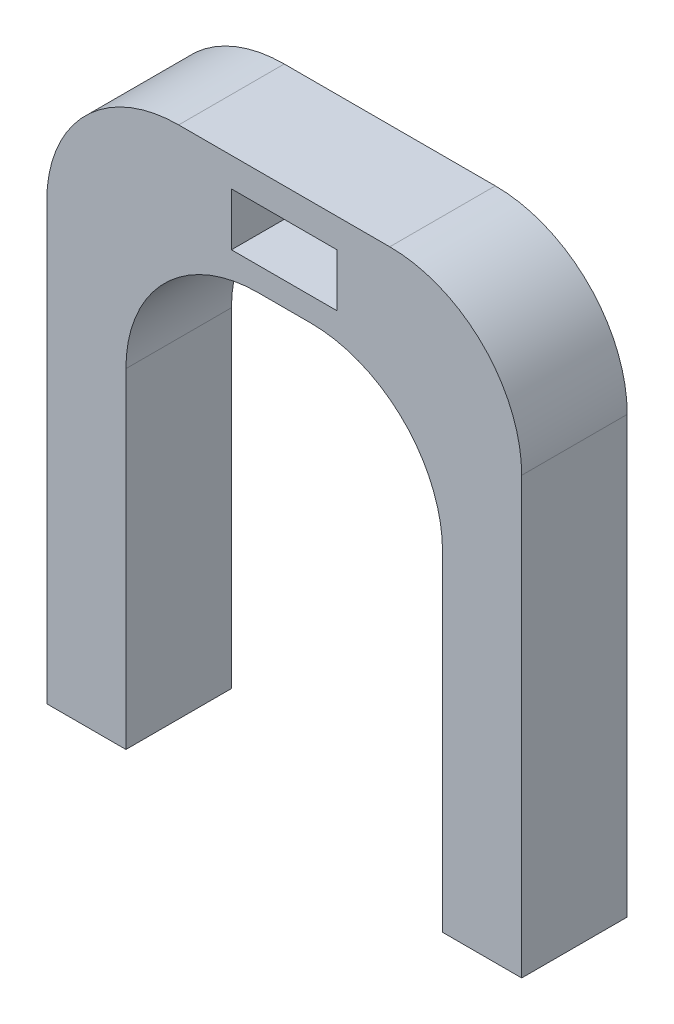
from build123d import *

# Parameters (mm, degrees)
SKETCH_2_W          = 18
SKETCH_2_H          = 21.5
EXTRUDE_1_DEPTH     = 4
SKETCH_3_W          = 12
SKETCH_3_H          = 17.5
CUT_EXTRUDE_1_DEPTH = 29.324018077
FILLET_1_R          = 5
FILLET_2_R          = 5
SKETCH_4_W          = 4
SKETCH_4_H          = 2
CUT_EXTRUDE_2_DEPTH = 29.324018077


with BuildPart() as part:
    # ｽｹｯﾁ2 → ﾎﾞｽ - 押し出し1 (new body)
    with BuildSketch(Plane.XY):
        with Locations((9, 10.75)):
            Rectangle(SKETCH_2_W, SKETCH_2_H)
    extrude(amount=EXTRUDE_1_DEPTH)

    # ｽｹｯﾁ3 → ｶｯﾄ - 押し出し1 (cut, through all)
    with BuildSketch(Plane.XY.offset(4)):
        with Locations((9, 8.75)):
            Rectangle(SKETCH_3_W, SKETCH_3_H)
    extrude(amount=-CUT_EXTRUDE_1_DEPTH, mode=Mode.SUBTRACT)

    # ﾌｨﾚｯﾄ1
    fillet_1_edges = [part.edges().sort_by_distance(p)[0] for p in [
        (3, 17.5, 2),
        (15, 17.5, 2),
    ]]
    fillet(fillet_1_edges, radius=FILLET_1_R)

    # ﾌｨﾚｯﾄ2
    fillet_2_edges = [part.edges().sort_by_distance(p)[0] for p in [
        (0, 21.5, 2),
        (18, 21.5, 2),
    ]]
    fillet(fillet_2_edges, radius=FILLET_2_R)

    # ｽｹｯﾁ4 → ｶｯﾄ - 押し出し2 (cut, through all)
    with BuildSketch(Plane.XY.offset(4)):
        with Locations((9, 19.400947982)):
            Rectangle(SKETCH_4_W, SKETCH_4_H)
    extrude(amount=-CUT_EXTRUDE_2_DEPTH, mode=Mode.SUBTRACT)


solid = part.part
